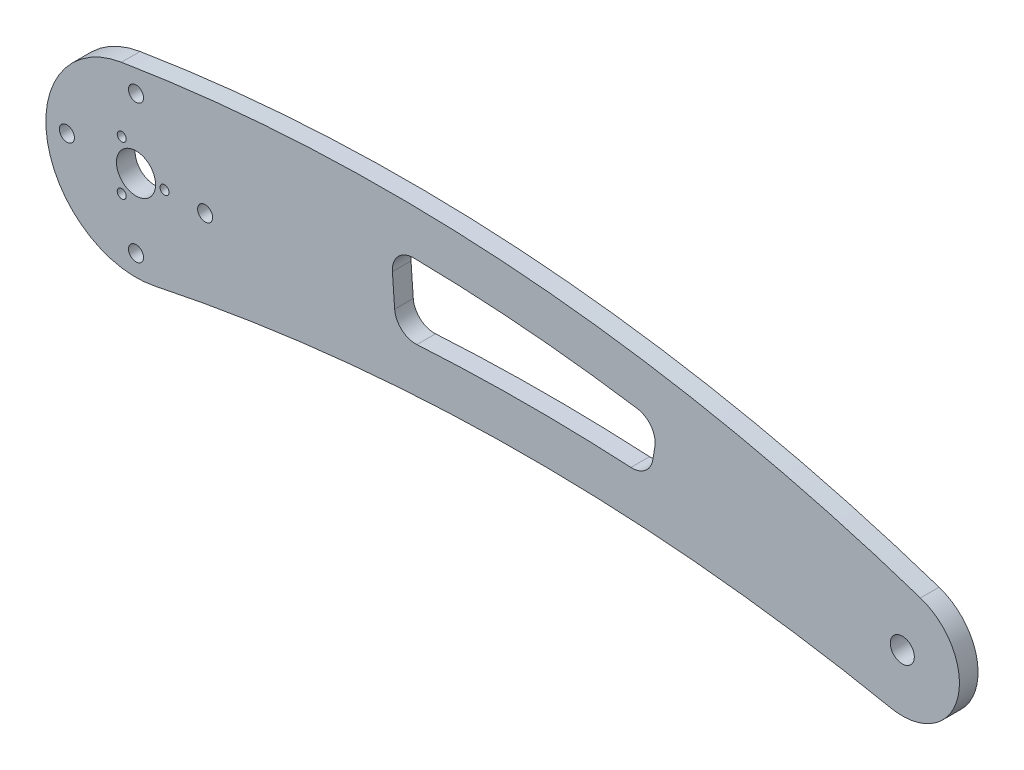
from build123d import *

# Parameters (mm, degrees)
SKETCH1_R           = 4
SKETCH1_R_2         = 2.5
SKETCH1_R_3         = 6.5
BOSS_EXTRUDE1_DEPTH = 6.2
CUT_EXTRUDE1_REACH  = 278.492
SKETCH2_R           = 1.5


with BuildPart() as part:
    # Sketch1 → Boss-Extrude1 (new body)
    with BuildSketch(Plane.XY):
        with BuildLine():
            ThreePointArc((-4.843381354, 29.606446208), (-29.489039073, -5.513308858), (6.180402599, -29.356474988))
            ThreePointArc((6.180402599, -29.356474988), (128.63005147, -16.382678773), (251.170355628, -28.47026553))
            ThreePointArc((251.170355628, -28.47026553), (273.303133895, -14.765534175), (260.982883768, 8.166778664))
            ThreePointArc((260.982883768, 8.166778664), (129.376669821, 35.090841966), (-4.843381354, 29.606446208))
        make_face()
        with Locations(Location((254.95, -9.85, 0), (0, 0, 180))):
            Circle(SKETCH1_R, mode=Mode.SUBTRACT)
        with Locations(Location((0, 23, 0), (0, 0, 180))):
            Circle(SKETCH1_R_2, mode=Mode.SUBTRACT)
        with Locations(Location((0, -23, 0), (0, 0, 180))):
            Circle(SKETCH1_R_2, mode=Mode.SUBTRACT)
        with Locations(Location((-23, 0, 0), (0, 0, 180))):
            Circle(SKETCH1_R_2, mode=Mode.SUBTRACT)
        with Locations(Location((23, 0, 0), (0, 0, 180))):
            Circle(SKETCH1_R_2, mode=Mode.SUBTRACT)
        with Locations(Location((0, 0, 0), (0, 0, 180))):
            Circle(SKETCH1_R_3, mode=Mode.SUBTRACT)
        with BuildLine():
            Line((85.299988347, 14.334161591), (86.047515876, 3.894174942))
            ThreePointArc((86.047515876, 3.894174942), (88.416575223, -0.870831987), (93.451584576, -2.593160073))
            ThreePointArc((93.451584576, -2.593160073), (129.051714651, -1.468455886), (164.657677356, -2.390215498))
            ThreePointArc((164.657677356, -2.390215498), (169.415573807, -0.864394835), (171.943987902, 3.445225739))
            Line((171.943987902, 3.445225739), (172.629734019, 7.547504331))
            ThreePointArc((172.629734019, 7.547504331), (171.396804828, 12.804877005), (166.788880257, 15.62038992))
            ThreePointArc((166.788880257, 15.62038992), (129.692411097, 20.014503602), (92.380913243, 21.833400801))
            ThreePointArc((92.380913243, 21.833400801), (87.192448356, 19.639856576), (85.299988347, 14.334161591))
        make_face(mode=Mode.SUBTRACT)
    extrude(amount=BOSS_EXTRUDE1_DEPTH)

    # Sketch2 → Cut-Extrude1 (cut, up to next)
    with BuildSketch(Plane.XY.offset(6.2), mode=Mode.PRIVATE) as cut_extrude1_sk1:
        with Locations((-4.75, -8.227241336)):
            Circle(SKETCH2_R)
    cut_extrude1_tool1 = extrude(cut_extrude1_sk1.sketch, amount=-CUT_EXTRUDE1_REACH, mode=Mode.PRIVATE) & part.part
    # Sketch2 → Cut-Extrude1 (cut, up to next)
    with BuildSketch(Plane.XY.offset(6.2), mode=Mode.PRIVATE) as cut_extrude1_sk2:
        with Locations((-4.75, 8.227241336)):
            Circle(SKETCH2_R)
    cut_extrude1_tool2 = extrude(cut_extrude1_sk2.sketch, amount=-CUT_EXTRUDE1_REACH, mode=Mode.PRIVATE) & part.part
    # Sketch2 → Cut-Extrude1 (cut, up to next)
    with BuildSketch(Plane.XY.offset(6.2), mode=Mode.PRIVATE) as cut_extrude1_sk3:
        with Locations((9.5, 0)):
            Circle(SKETCH2_R)
    cut_extrude1_tool3 = extrude(cut_extrude1_sk3.sketch, amount=-CUT_EXTRUDE1_REACH, mode=Mode.PRIVATE) & part.part
    add(cut_extrude1_tool1.solids().sort_by_distance((-4.75, -8.227241, 6.2))[0], mode=Mode.SUBTRACT)
    add(cut_extrude1_tool2.solids().sort_by_distance((-4.75, 8.227241, 6.2))[0], mode=Mode.SUBTRACT)
    add(cut_extrude1_tool3.solids().sort_by_distance((9.5, 0, 6.2))[0], mode=Mode.SUBTRACT)


solid = part.part
